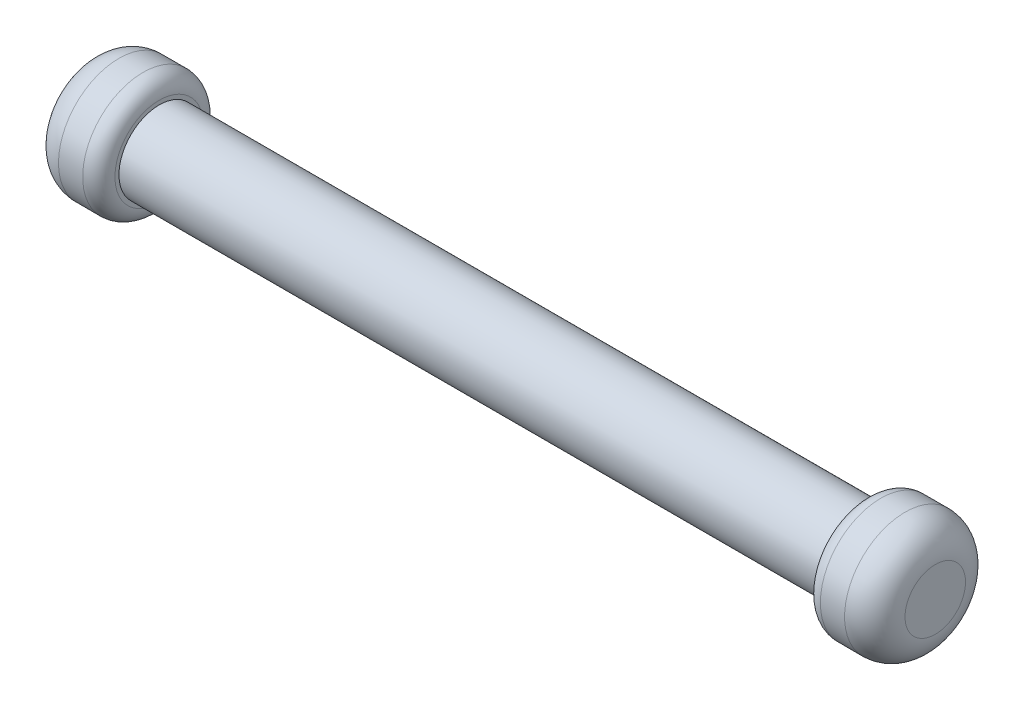
from build123d import *

# Parameters (mm, degrees)
FILLET_1_R = 0.8
FILLET_2_R = 1.5


with BuildPart() as part:
    # Эскиз1 → Повернуть1 (revolve)
    with BuildSketch(Plane.XY, mode=Mode.PRIVATE) as revolve_1_sk:
        Polygon((0, 0), (0, 3), (3.5, 3), (3.5, 2), (38.5, 2), (38.5, 3), (42, 3), (42, 0), align=None)
    revolve(revolve_1_sk.sketch.rotate(Axis((0, 0, 0), (-1, 0, 0)), 90), axis=Axis((0, 0, 0), (-1, 0, 0)))

    # Скругление1
    fillet_1_edges = [part.edges().sort_by_distance(p)[0] for p in [
        (38.5, 0, 3),
        (3.5, 0, 3),
    ]]
    fillet(fillet_1_edges, radius=FILLET_1_R)

    # Скругление2
    fillet_2_edges = [part.edges().sort_by_distance(p)[0] for p in [
        (42, 0, 3),
        (0, 0, 3),
    ]]
    fillet(fillet_2_edges, radius=FILLET_2_R)


solid = part.part
